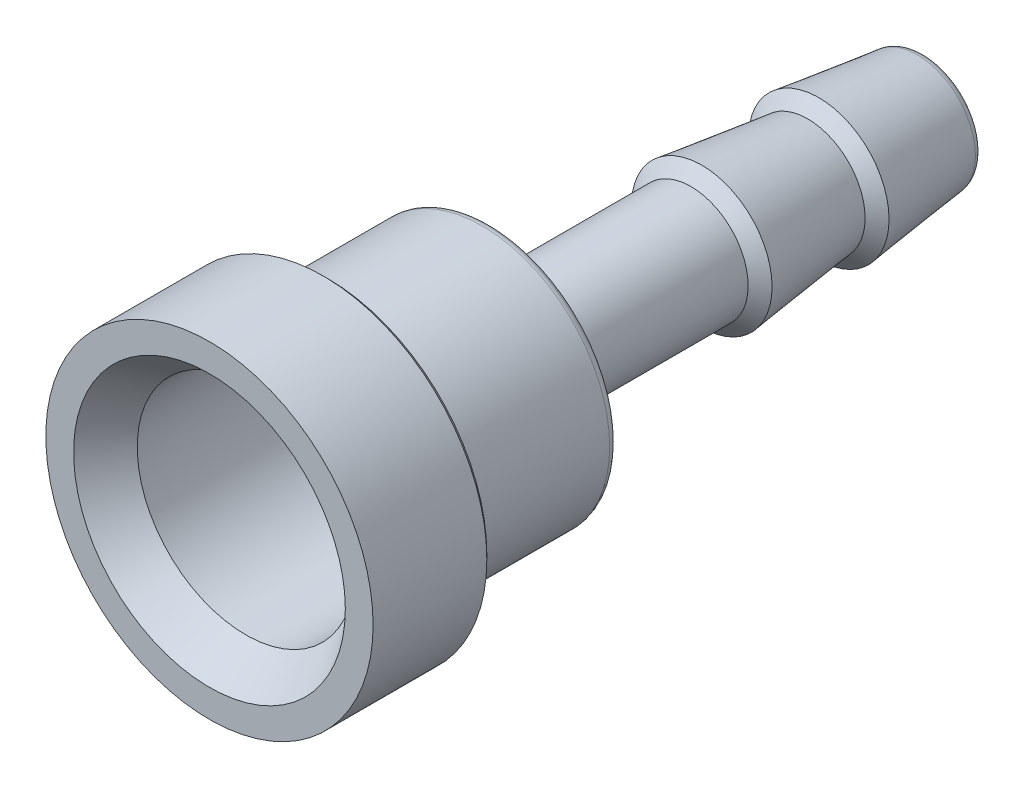
from build123d import *

# Parameters (mm, degrees)
FILLET2_R = 0.254


with BuildPart() as part:
    # Sketch1 → Revolve1 (revolve)
    with BuildSketch(Plane(origin=(0, 0, 0), x_dir=(0, 0, -1), z_dir=(1, 0, 0)), mode=Mode.PRIVATE) as revolve1_sk:
        Polygon((7.541506618, 1.11125), (20.9296, 1.11125), (20.9296, 1.6764), (17.826604011, 2.0574), (17.506907051, 1.6764), (14.403911062, 2.0574), (14.084214103, 1.6764), (8.2296, 1.6764), (8.2296, 3.7338), (3.4544, 3.7338), (3.4544, 4.6609), (3.3274, 4.7879), (0, 4.7879), (0, 3.9751), (1.061768562, 3.175), (6.35, 3.175), align=None)
    revolve(revolve1_sk.sketch.rotate(Axis((0, 0, -9.412698919), (0, 0, -1)), 90), axis=Axis((0, 0, -9.412698919), (0, 0, -1)))

    # Fillet2
    fillet2_edges = [part.edges().sort_by_distance(p)[0] for p in [
        (-3.7338, 0, -8.2296),
        (-1.6764, 0, -20.9296),
    ]]
    fillet(fillet2_edges, radius=FILLET2_R)


solid = part.part
